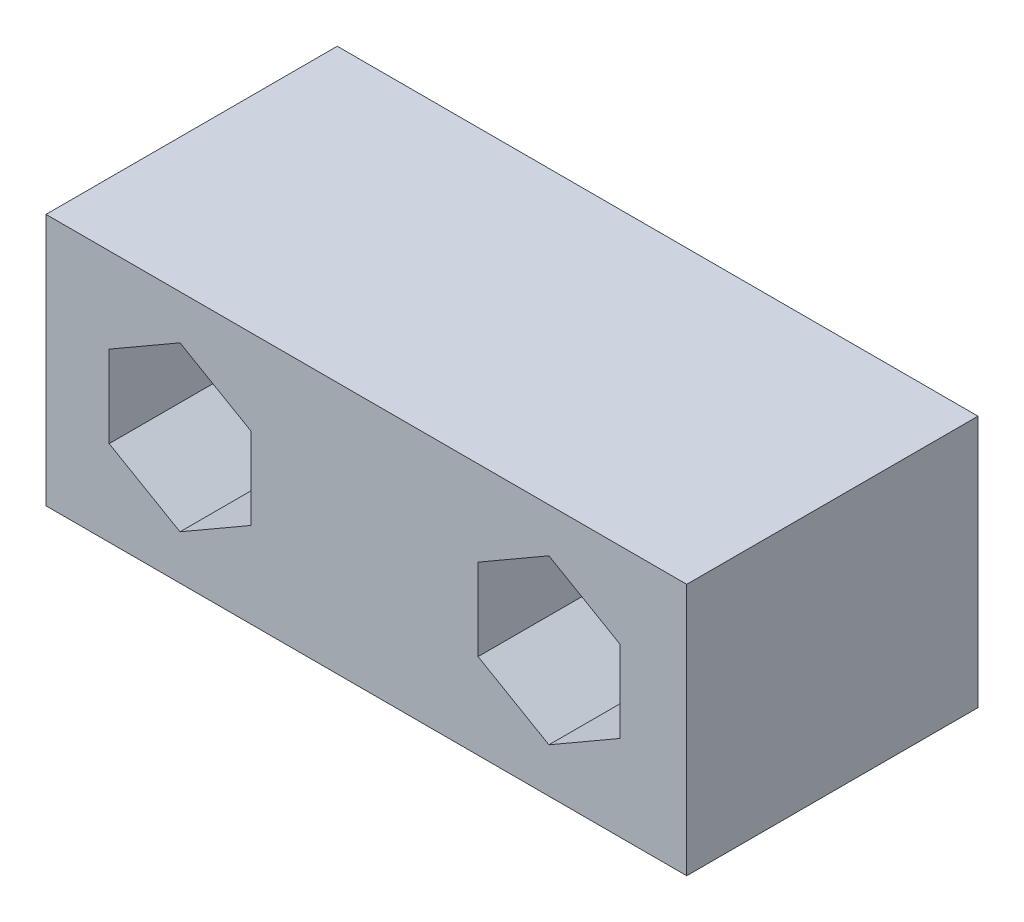
from build123d import *

# Parameters (mm, degrees)
SKETCH1_W           = 33
SKETCH1_H           = 13
BOSS_EXTRUDE1_DEPTH = 15


with BuildPart() as part:
    # Sketch1 → Boss-Extrude1 (new body)
    with BuildSketch(Plane.XY.offset(7.5)):
        with Locations((-34.402245287, 0)):
            Rectangle(SKETCH1_W, SKETCH1_H)
        Polygon((-47.65, -2.099186911), (-47.65, 2.115470054), (-44, 4.222798536), (-40.35, 2.115470054), (-40.35, -2.099186911), (-44, -4.206515394), align=None, mode=Mode.SUBTRACT)
        Polygon((-28.65, -2.099186911), (-28.65, 2.115470054), (-25, 4.222798536), (-21.35, 2.115470054), (-21.35, -2.099186911), (-25, -4.206515394), align=None, mode=Mode.SUBTRACT)
    extrude(amount=-BOSS_EXTRUDE1_DEPTH)


solid = part.part
